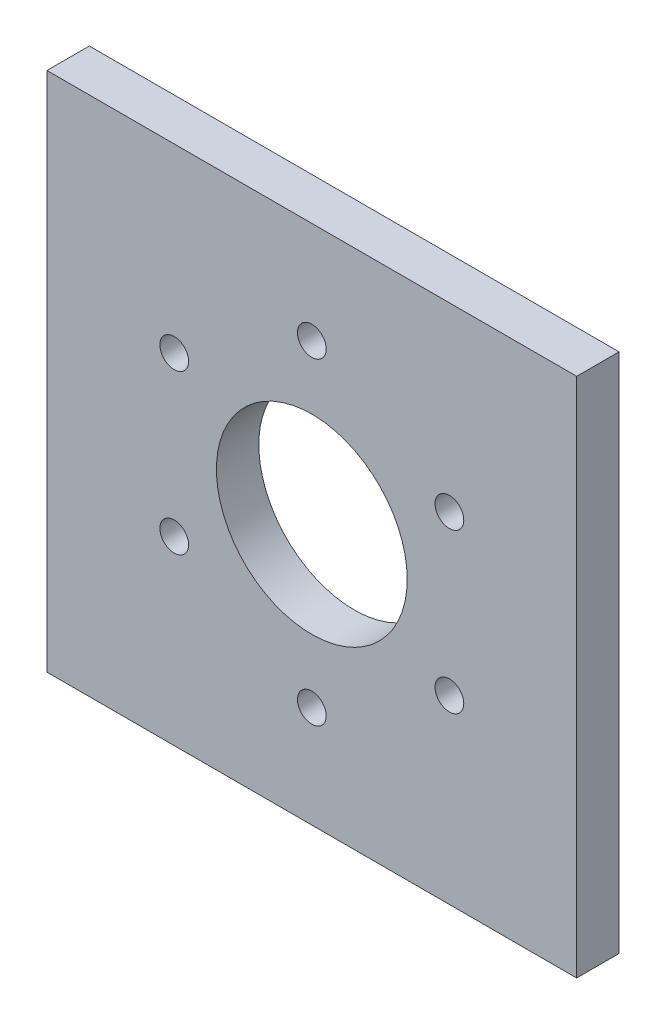
from build123d import *

# Parameters (mm, degrees)
BOSS_EXTRUDE1_DEPTH = 6.35


with BuildPart() as part:
    # Sketch1 → Boss-Extrude1 (new body)
    with BuildSketch(Plane.XY):
        Polygon((0, 39.0525), (39.7, 39.0525), (39.7, 0), (39.7, -39.0525), (0, -39.0525), (-39.7, -39.0525), (-39.7, 0), (-39.7, 39.0525), align=None)
        with BuildLine():
            ThreePointArc((2.15265, 23.8125), (0, 25.96515), (-2.15265, 23.8125))
            ThreePointArc((-2.15265, 23.8125), (0, 21.65985), (2.15265, 23.8125))
        make_face(mode=Mode.SUBTRACT)
        with BuildLine():
            ThreePointArc((-14.3, 0), (0, -14.3), (14.3, 0))
            ThreePointArc((14.3, 0), (0, 14.3), (-14.3, 0))
        make_face(mode=Mode.SUBTRACT)
        with BuildLine():
            ThreePointArc((-22.774879928, 11.90625), (-20.622229928, 9.7536), (-18.469579928, 11.90625))
            ThreePointArc((-18.469579928, 11.90625), (-20.622229928, 14.0589), (-22.774879928, 11.90625))
        make_face(mode=Mode.SUBTRACT)
        with BuildLine():
            ThreePointArc((-22.774879928, -11.90625), (-20.622229928, -14.0589), (-18.469579928, -11.90625))
            ThreePointArc((-18.469579928, -11.90625), (-20.622229928, -9.7536), (-22.774879928, -11.90625))
        make_face(mode=Mode.SUBTRACT)
        with BuildLine():
            ThreePointArc((-2.15265, -23.8125), (0, -25.96515), (2.15265, -23.8125))
            ThreePointArc((2.15265, -23.8125), (0, -21.65985), (-2.15265, -23.8125))
        make_face(mode=Mode.SUBTRACT)
        with BuildLine():
            ThreePointArc((18.469579928, 11.90625), (20.622229928, 9.7536), (22.774879928, 11.90625))
            ThreePointArc((22.774879928, 11.90625), (20.622229928, 14.0589), (18.469579928, 11.90625))
        make_face(mode=Mode.SUBTRACT)
        with BuildLine():
            ThreePointArc((18.469579928, -11.90625), (20.622229928, -14.0589), (22.774879928, -11.90625))
            ThreePointArc((22.774879928, -11.90625), (20.622229928, -9.7536), (18.469579928, -11.90625))
        make_face(mode=Mode.SUBTRACT)
    extrude(amount=BOSS_EXTRUDE1_DEPTH)


solid = part.part
